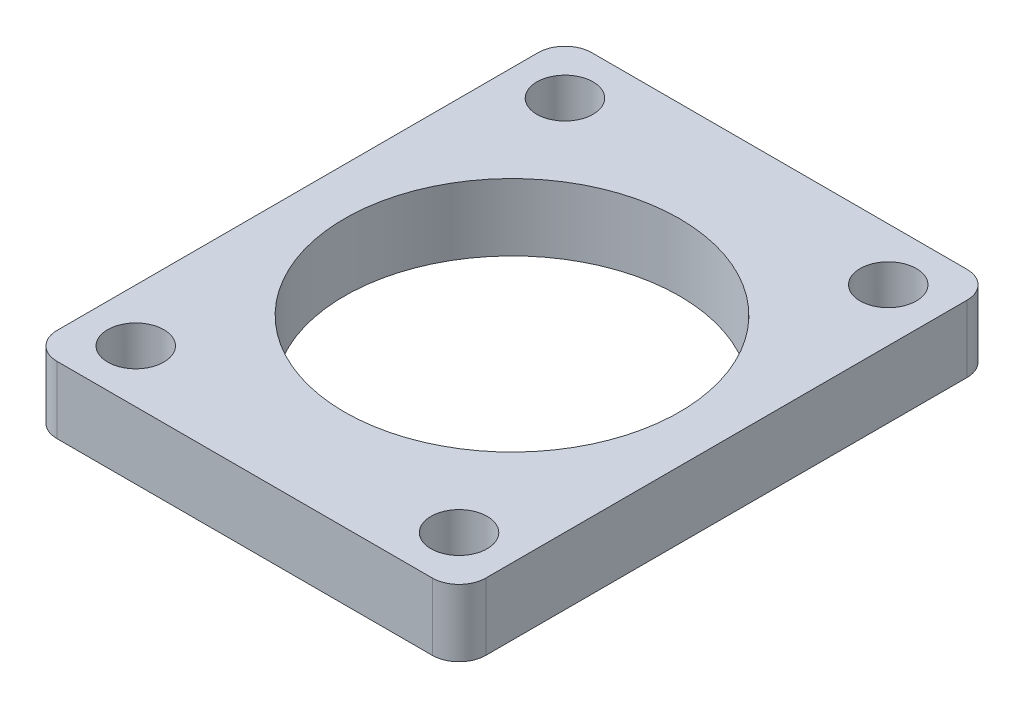
from build123d import *

# Parameters (mm, degrees)
SKETCH1_W           = 40.64
SKETCH1_H           = 50.673
SKETCH1_R           = 15.875
BOSS_EXTRUDE1_DEPTH = 6.35
CUT_EXTRUDE1_REACH  = 35.093
SKETCH2_R           = 2.665
FILLET1_R           = 2.54


with BuildPart() as part:
    # Sketch1 → Boss-Extrude1 (new body)
    with BuildSketch(Plane(origin=(0, 0, 0), x_dir=(1, 0, 0), z_dir=(0, 1, 0))):
        Rectangle(SKETCH1_W, SKETCH1_H)
        with Locations(Location((0, 0, 0), (0, 0, 270))):
            Circle(SKETCH1_R, mode=Mode.SUBTRACT)
    extrude(amount=BOSS_EXTRUDE1_DEPTH)

    # Sketch2 → Cut-Extrude1 (cut, up to next)
    with BuildSketch(Plane(origin=(0, 6.35, 0), x_dir=(1, 0, 0), z_dir=(0, 1, 0)), mode=Mode.PRIVATE) as cut_extrude1_sk1:
        with Locations(Location((-15.32, 20.3365, 0), (0, 0, 270))):
            Circle(SKETCH2_R)
    cut_extrude1_tool1 = extrude(cut_extrude1_sk1.sketch, amount=-CUT_EXTRUDE1_REACH, mode=Mode.PRIVATE) & part.part
    # Sketch2 → Cut-Extrude1 (cut, up to next)
    with BuildSketch(Plane(origin=(0, 6.35, 0), x_dir=(1, 0, 0), z_dir=(0, 1, 0)), mode=Mode.PRIVATE) as cut_extrude1_sk2:
        with Locations(Location((15.32, 20.3365, 0), (0, 0, 270))):
            Circle(SKETCH2_R)
    cut_extrude1_tool2 = extrude(cut_extrude1_sk2.sketch, amount=-CUT_EXTRUDE1_REACH, mode=Mode.PRIVATE) & part.part
    # Sketch2 → Cut-Extrude1 (cut, up to next)
    with BuildSketch(Plane(origin=(0, 6.35, 0), x_dir=(1, 0, 0), z_dir=(0, 1, 0)), mode=Mode.PRIVATE) as cut_extrude1_sk3:
        with Locations(Location((15.32, -20.3365, 0), (0, 0, 270))):
            Circle(SKETCH2_R)
    cut_extrude1_tool3 = extrude(cut_extrude1_sk3.sketch, amount=-CUT_EXTRUDE1_REACH, mode=Mode.PRIVATE) & part.part
    # Sketch2 → Cut-Extrude1 (cut, up to next)
    with BuildSketch(Plane(origin=(0, 6.35, 0), x_dir=(1, 0, 0), z_dir=(0, 1, 0)), mode=Mode.PRIVATE) as cut_extrude1_sk4:
        with Locations(Location((-15.32, -20.3365, 0), (0, 0, 270))):
            Circle(SKETCH2_R)
    cut_extrude1_tool4 = extrude(cut_extrude1_sk4.sketch, amount=-CUT_EXTRUDE1_REACH, mode=Mode.PRIVATE) & part.part
    add(cut_extrude1_tool1.solids().sort_by_distance((-15.32, 6.35, -20.3365))[0], mode=Mode.SUBTRACT)
    add(cut_extrude1_tool2.solids().sort_by_distance((15.32, 6.35, -20.3365))[0], mode=Mode.SUBTRACT)
    add(cut_extrude1_tool3.solids().sort_by_distance((15.32, 6.35, 20.3365))[0], mode=Mode.SUBTRACT)
    add(cut_extrude1_tool4.solids().sort_by_distance((-15.32, 6.35, 20.3365))[0], mode=Mode.SUBTRACT)

    # Fillet1
    fillet1_edges = [part.edges().sort_by_distance(p)[0] for p in [
        (20.32, 3.175, 25.3365),
        (-20.32, 3.175, 25.3365),
        (-20.32, 3.175, -25.3365),
        (20.32, 3.175, -25.3365),
    ]]
    fillet(fillet1_edges, radius=FILLET1_R)


solid = part.part
